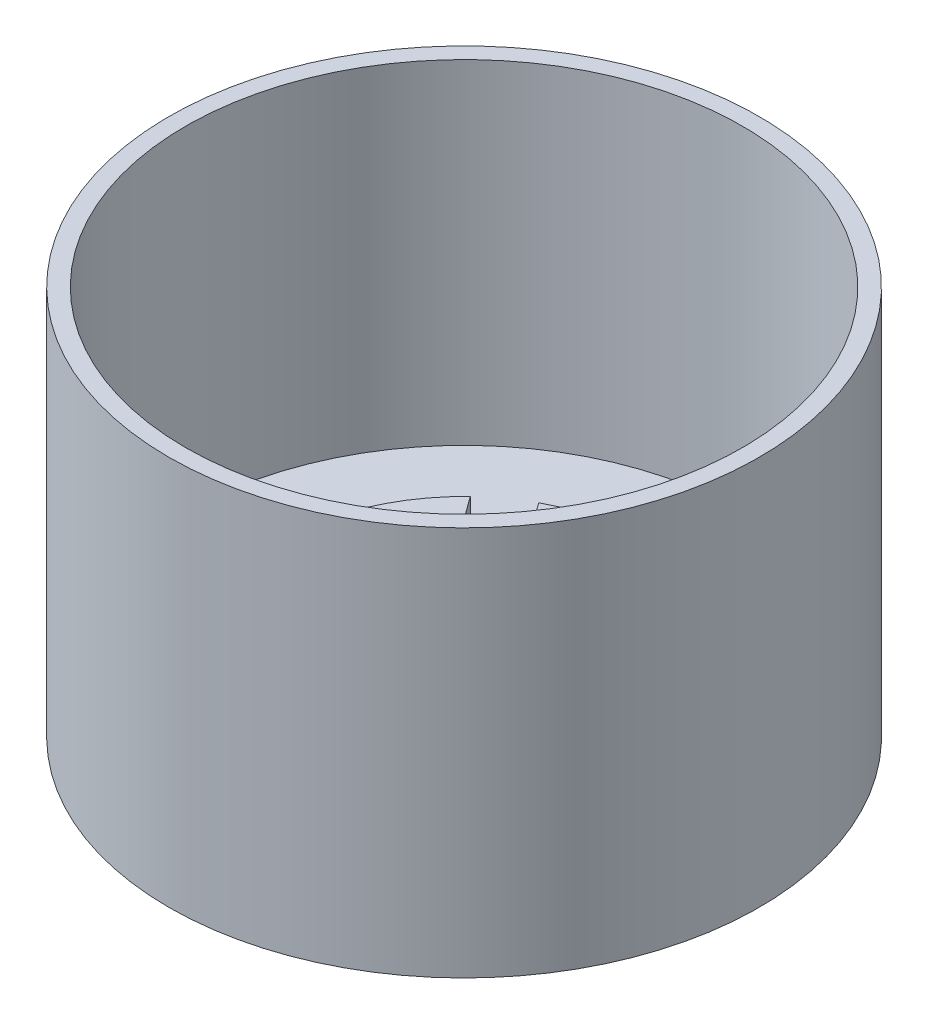
from build123d import *

# Parameters (mm, degrees)
SKETCH_1_R          = 26.5
EXTRUDE_1_DEPTH     = 5
SKETCH_2_R          = 26.5
SKETCH_2_R_2        = 25
EXTRUDE_2_DEPTH     = 30
SKETCH_3_R          = 2.1
CUT_EXTRUDE_1_DEPTH = 10
EXTRUDE_3_DEPTH     = 2


with BuildPart() as part:
    # 草图1 → 凸台-拉伸1 (new body)
    with BuildSketch(Plane(origin=(0, 0, 0), x_dir=(1, 0, 0), z_dir=(0, 1, 0))):
        with Locations(Location((0, 0, 0), (0, 0, 270))):
            Circle(SKETCH_1_R)
    extrude(amount=EXTRUDE_1_DEPTH)

    # 草图2 → 凸台-拉伸2 (add)
    with BuildSketch(Plane(origin=(0, 5, 0), x_dir=(1, 0, 0), z_dir=(0, 1, 0))):
        with Locations(Location((0, 0, 0), (0, 0, 270))):
            Circle(SKETCH_2_R)
        with Locations(Location((0, 0, 0), (0, 0, 270))):
            Circle(SKETCH_2_R_2, mode=Mode.SUBTRACT)
    extrude(amount=EXTRUDE_2_DEPTH)

    # 草图3 → 切除-拉伸1 (cut)
    with BuildSketch(Plane.XZ):
        with Locations(Location((0, 0, 0), (0, 0, 270))):
            Circle(SKETCH_3_R)
    extrude(amount=-CUT_EXTRUDE_1_DEPTH, mode=Mode.SUBTRACT)

    # 草图4 → 凸台-拉伸3 (add)
    with BuildSketch(Plane(origin=(0, 5, 0), x_dir=(1, 0, 0), z_dir=(0, 1, 0))):
        with BuildLine():
            ThreePointArc((-13.829204077, -2.180163894), (-13.314791228, 4.326237921), (-9.906592932, 9.892391848))
            Line((-9.906592932, 9.892391848), (-11.421352179, 11.97727909))
            ThreePointArc((-11.421352179, 11.97727909), (-15.739985345, 5.114231257), (-16.280136023, -2.976519958))
            Line((-16.280136023, -2.976519958), (-13.829204077, -2.180163894))
        make_face()
        with BuildLine():
            ThreePointArc((-6.346918157, 12.478646958), (0, 14), (6.346918157, 12.478646958))
            Line((6.346918157, 12.478646958), (7.861677404, 14.5635342))
            ThreePointArc((7.861677404, 14.5635342), (0, 16.55), (-7.861677404, 14.5635342))
            Line((-7.861677404, 14.5635342), (-6.346918157, 12.478646958))
        make_face()
        with BuildLine():
            ThreePointArc((14, 0), (13.957235705, -1.093421906), (13.829204077, -2.180163894))
            Line((13.829204077, -2.180163894), (16.280136023, -2.976519958))
            ThreePointArc((16.280136023, -2.976519958), (16.48239593, -1.494364215), (16.55, 0))
            ThreePointArc((16.55, 0), (15.213906115, 6.514565275), (11.421352179, 11.97727909))
            Line((11.421352179, 11.97727909), (9.906592932, 9.892391848))
            ThreePointArc((9.906592932, 9.892391848), (12.936234016, 5.352929056), (14, 0))
        make_face()
        with BuildLine():
            ThreePointArc((12.469529301, -6.364812566), (8.228993532, -11.326237921), (2.2, -13.826062346))
            Line((2.2, -13.826062346), (2.2, -16.403124702))
            ThreePointArc((2.2, -16.403124702), (9.727845925, -13.389231257), (14.920461248, -7.16116863))
            Line((14.920461248, -7.16116863), (12.469529301, -6.364812566))
        make_face()
        with BuildLine():
            Line((-2.2, -16.403124702), (-2.2, -13.826062346))
            ThreePointArc((-2.2, -13.826062346), (-8.228993532, -11.326237921), (-12.469529301, -6.364812566))
            Line((-12.469529301, -6.364812566), (-14.920461248, -7.16116863))
            ThreePointArc((-14.920461248, -7.16116863), (-9.727845925, -13.389231257), (-2.2, -16.403124702))
        make_face()
    extrude(amount=EXTRUDE_3_DEPTH)


solid = part.part
